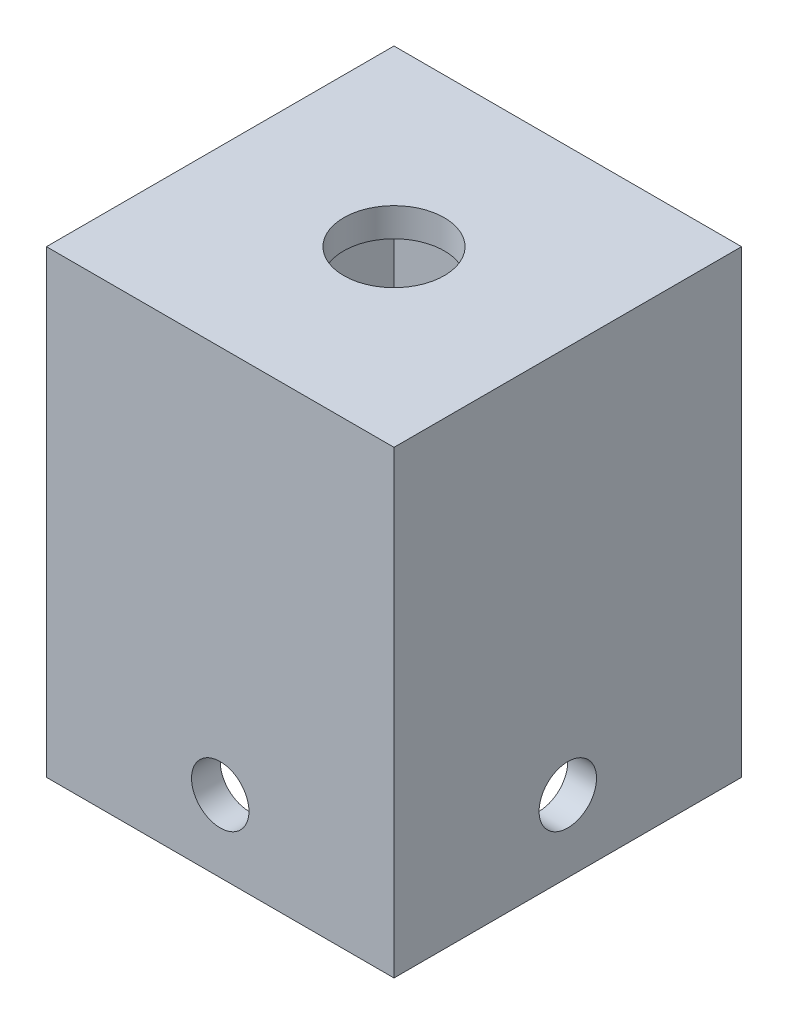
from build123d import *

# Parameters (mm, degrees)
SKETCH1_W           = 24.2
SKETCH1_H           = 24.2
SKETCH1_W_2         = 20.2
SKETCH1_H_2         = 20.2
BOSS_EXTRUDE1_DEPTH = 30
SKETCH2_R           = 2
CUT_EXTRUDE1_DEPTH  = 30
SKETCH3_R           = 2
CUT_EXTRUDE2_DEPTH  = 30
SKETCH4_W           = 24.2
SKETCH4_H           = 24.2
SKETCH4_R           = 3.5
BOSS_EXTRUDE2_DEPTH = 2


with BuildPart() as part:
    # Sketch1 → Boss-Extrude1 (new body)
    with BuildSketch(Plane(origin=(0, 0, 0), x_dir=(1, 0, 0), z_dir=(0, 1, 0))):
        Rectangle(SKETCH1_W, SKETCH1_H)
        Rectangle(SKETCH1_W_2, SKETCH1_H_2, mode=Mode.SUBTRACT)
    extrude(amount=BOSS_EXTRUDE1_DEPTH)

    # Sketch2 → Cut-Extrude1 (cut)
    with BuildSketch(Plane.XY.offset(12.1)):
        with Locations((0, 5)):
            Circle(SKETCH2_R)
    extrude(amount=-CUT_EXTRUDE1_DEPTH, mode=Mode.SUBTRACT)

    # Sketch3 → Cut-Extrude2 (cut)
    with BuildSketch(Plane(origin=(12.1, 0, 0), x_dir=(0, 0, -1), z_dir=(1, 0, 0))):
        with Locations((0, 5)):
            Circle(SKETCH3_R)
    extrude(amount=-CUT_EXTRUDE2_DEPTH, mode=Mode.SUBTRACT)

    # Sketch4 → Boss-Extrude2 (add)
    with BuildSketch(Plane(origin=(0, 30, 0), x_dir=(1, 0, 0), z_dir=(0, 1, 0))):
        Rectangle(SKETCH4_W, SKETCH4_H)
        with Locations(Location((0, 0, 0), (0, 0, 270))):
            Circle(SKETCH4_R, mode=Mode.SUBTRACT)
    extrude(amount=BOSS_EXTRUDE2_DEPTH)


solid = part.part
